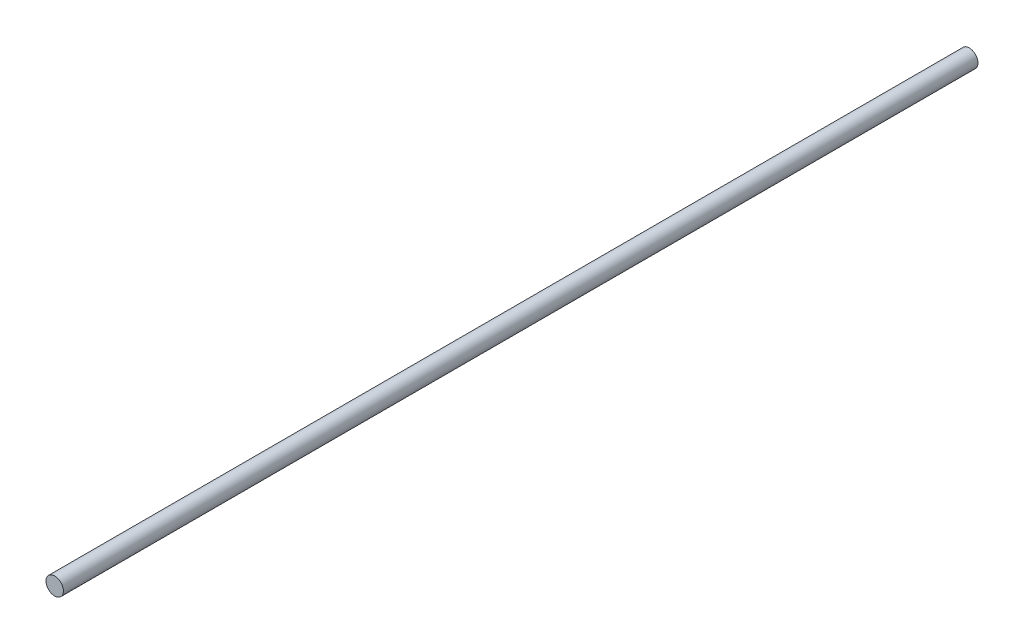
from build123d import *

# Parameters (mm, degrees)
SKETCH_1_R      = 4
EXTRUDE_1_DEPTH = 420


with BuildPart() as part:
    # 草图1 → 凸台-拉伸1 (new body)
    with BuildSketch(Plane.XY):
        with Locations((-12.385714286, 7.892857143)):
            Circle(SKETCH_1_R)
    extrude(amount=EXTRUDE_1_DEPTH)


solid = part.part
